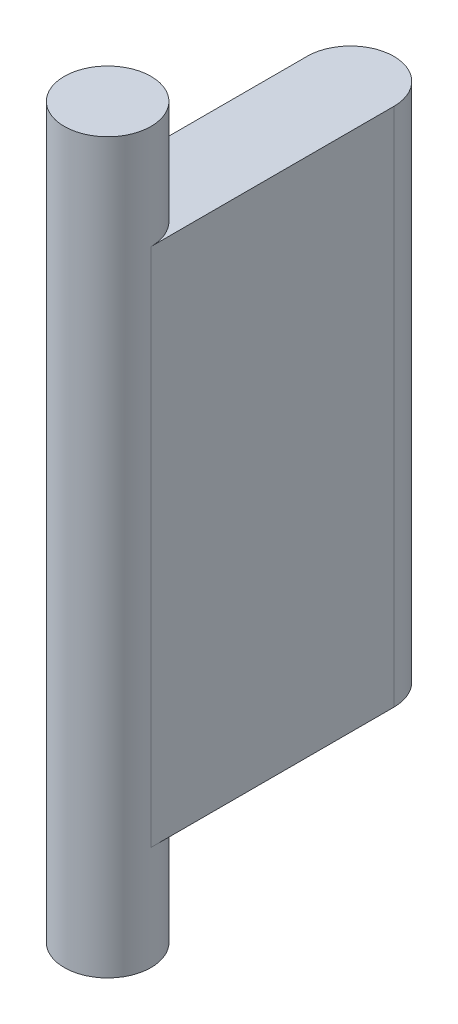
from build123d import *

# Parameters (mm, degrees)
EXTRUDE_1_DEPTH = 15
SKETCH_2_R      = 1.25
EXTRUDE_2_DEPTH = 3
EXTRUDE_START   = 3
SKETCH_3_R      = 1.25
EXTRUDE_3_DEPTH = 3


with BuildPart() as part:
    # 草图1 → 凸台-拉伸1 (new body)
    with BuildSketch(Plane(origin=(0, 0, 0), x_dir=(1, 0, 0), z_dir=(0, 1, 0))):
        with BuildLine():
            Line((-1.25, 0), (-1.25, 7))
            ThreePointArc((-1.25, 7), (0, 8.25), (1.25, 7))
            Line((1.25, 7), (1.25, 0))
            ThreePointArc((1.25, 0), (0, -1.25), (-1.25, 0))
        make_face()
    extrude(amount=EXTRUDE_1_DEPTH)

    # 草图2 → 凸台-拉伸2 (add)
    with BuildSketch(Plane(origin=(0, 15, 0), x_dir=(1, 0, 0), z_dir=(0, 1, 0))):
        Circle(SKETCH_2_R)
    extrude(amount=EXTRUDE_2_DEPTH)

    # 草图3 → 凸台-拉伸3 (add)
    with BuildSketch(Plane.XZ.offset(EXTRUDE_START)):
        with Locations(Location((0, 0, 0), (0, 0, 270))):
            Circle(SKETCH_3_R)
    extrude(amount=-EXTRUDE_3_DEPTH)


solid = part.part
